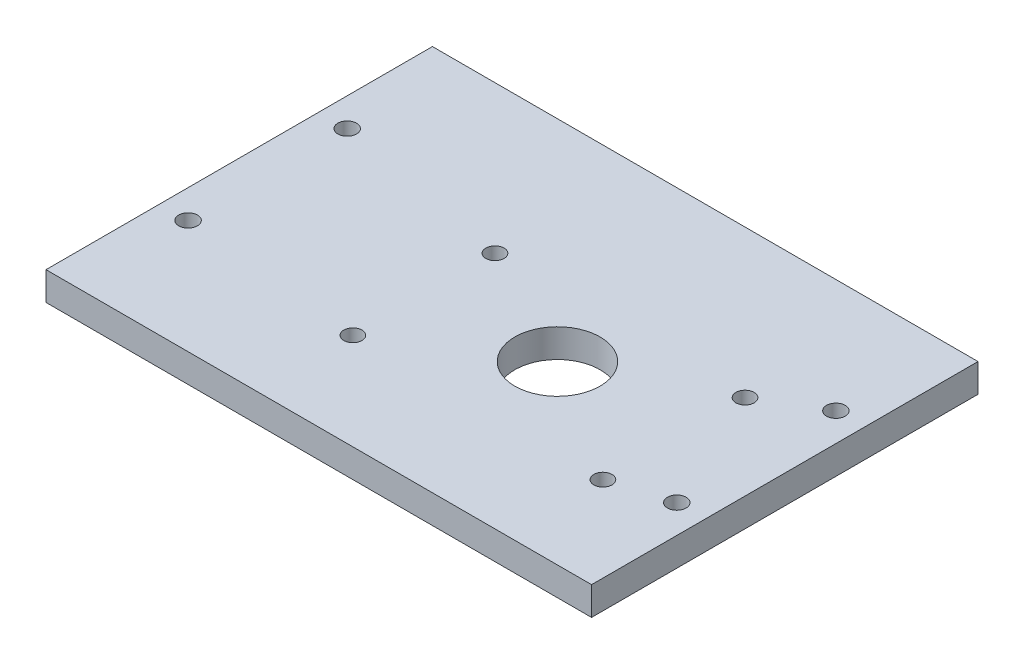
from build123d import *

# Parameters (mm, degrees)
SKETCH1_W           = 96
SKETCH1_H           = 68
BOSS_EXTRUDE1_DEPTH = 5
SKETCH2_R           = 1.65
SKETCH2_R_2         = 1.6
SKETCH2_R_3         = 7.5
CUT_EXTRUDE1_DEPTH  = 60.033888573


with BuildPart() as part:
    # Sketch1 → Boss-Extrude1 (new body)
    with BuildSketch(Plane(origin=(0, 0, 0), x_dir=(1, 0, 0), z_dir=(0, 1, 0))):
        Rectangle(SKETCH1_W, SKETCH1_H)
    extrude(amount=BOSS_EXTRUDE1_DEPTH)

    # Sketch2 → Cut-Extrude1 (cut, through all)
    with BuildSketch(Plane(origin=(0, 5, 0), x_dir=(1, 0, 0), z_dir=(0, 1, 0))):
        with Locations(Location((-43, 14, 0), (0, 0, 270))):
            Circle(SKETCH2_R)
        with Locations(Location((43, 14, 0), (0, 0, 270))):
            Circle(SKETCH2_R)
        with Locations(Location((43, -14, 0), (0, 0, 270))):
            Circle(SKETCH2_R)
        with Locations(Location((-43, -14, 0), (0, 0, 270))):
            Circle(SKETCH2_R)
        with Locations(Location((-11, 8, 0), (0, 0, 270))):
            Circle(SKETCH2_R_2)
        with Locations(Location((33, 8, 0), (0, 0, 270))):
            Circle(SKETCH2_R_2)
        with Locations(Location((33, -17, 0), (0, 0, 270))):
            Circle(SKETCH2_R_2)
        with Locations(Location((-11, -17, 0), (0, 0, 270))):
            Circle(SKETCH2_R_2)
        with Locations(Location((11, -3, 0), (0, 0, 270))):
            Circle(SKETCH2_R_3)
    extrude(amount=-CUT_EXTRUDE1_DEPTH, mode=Mode.SUBTRACT)


solid = part.part
